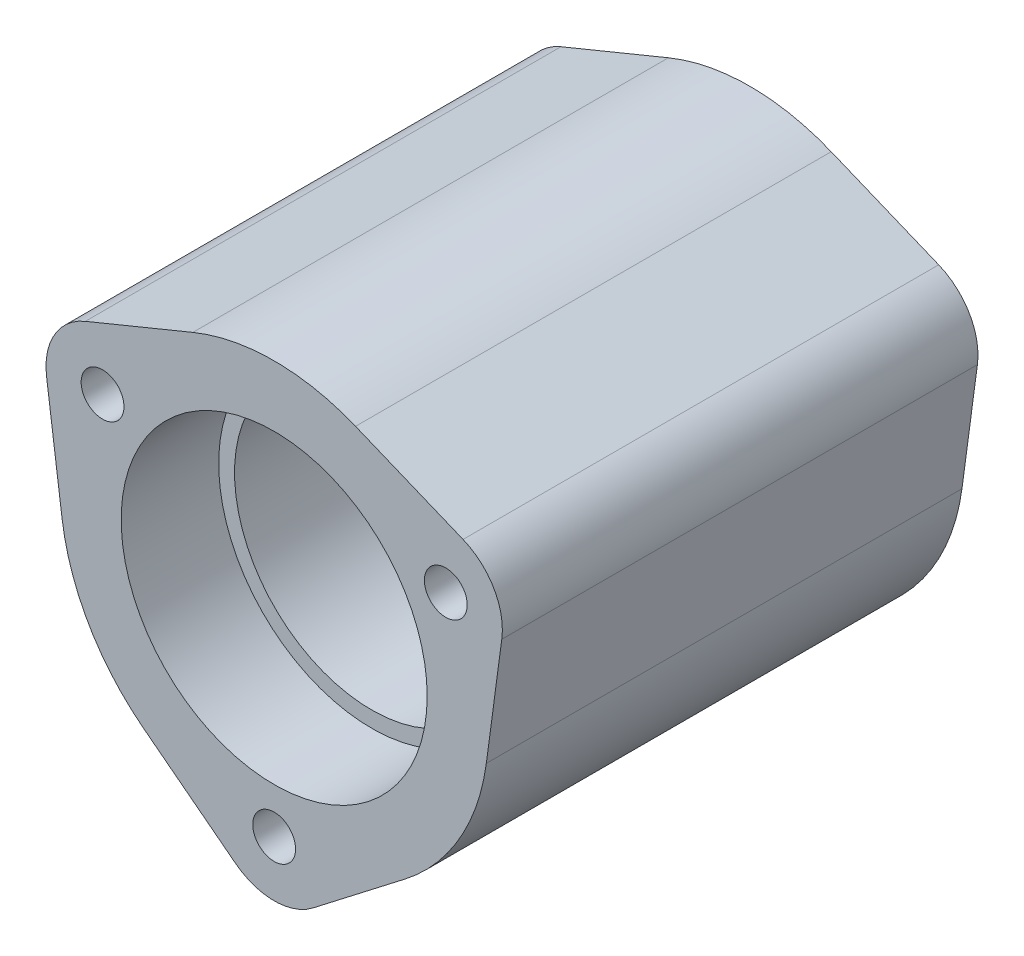
from build123d import *

# Parameters (mm, degrees)
EXTRUDE_769_DEPTH      = 15
SKETCH_2_R             = 9.65
CUT_EXTRUDE_1101_DEPTH = 6.15
SKETCH_3_R             = 8.65
CUT_EXTRUDE_1243_DEPTH = 33.124148841
SKETCH_4_R             = 1.35
CUT_EXTRUDE_1735_DEPTH = 11


with BuildPart() as part:
    # Эскиз1 → Extrude 769 (new, symmetric)
    with BuildSketch(Plane.XY):
        with BuildLine():
            Line((-11.912812099, 9.699737517), (-5.131711981, 12.486614118))
            ThreePointArc((-5.131711981, 12.486614118), (0, 13.5), (5.131711981, 12.486614118))
            Line((5.131711981, 12.486614118), (11.912812099, 9.699737517))
            ThreePointArc((11.912812099, 9.699737517), (13.856406461, 8), (14.356625149, 5.46692915))
            Line((14.356625149, 5.46692915), (13.379581024, -1.799114118))
            ThreePointArc((13.379581024, -1.799114118), (11.691342951, -6.75), (8.247869043, -10.6875))
            Line((8.247869043, -10.6875), (2.44381305, -15.166666667))
            ThreePointArc((2.44381305, -15.166666667), (0, -16), (-2.44381305, -15.166666667))
            Line((-2.44381305, -15.166666667), (-8.247869043, -10.6875))
            ThreePointArc((-8.247869043, -10.6875), (-11.691342951, -6.75), (-13.379581024, -1.799114118))
            Line((-13.379581024, -1.799114118), (-14.356625149, 5.46692915))
            ThreePointArc((-14.356625149, 5.46692915), (-13.856406461, 8), (-11.912812099, 9.699737517))
        make_face()
    extrude(amount=EXTRUDE_769_DEPTH, both=True)

    # Эскиз2 → Cut-Extrude 1101 (cut)
    with BuildSketch(Plane.XY.offset(15)):
        Circle(SKETCH_2_R)
    cut_extrude_1101 = extrude(amount=-CUT_EXTRUDE_1101_DEPTH, mode=Mode.SUBTRACT)

    # Mirror 1143: Cut-Extrude 1101 across plane
    add(cut_extrude_1101.mirror(Plane.XY), mode=Mode.SUBTRACT)

    # Эскиз3 → Cut-Extrude 1243 (cut, through all)
    with BuildSketch(Plane.XY.offset(8.85)):
        Circle(SKETCH_3_R)
    extrude(amount=-CUT_EXTRUDE_1243_DEPTH, mode=Mode.SUBTRACT)

    # Эскиз4 → Cut-Extrude 1735 (cut)
    with BuildSketch(Plane.XY.offset(15)):
        with Locations((-10.825317547, 6.25)):
            Circle(SKETCH_4_R)
        with Locations((0, -12.5)):
            Circle(SKETCH_4_R)
        with Locations((10.825317547, 6.25)):
            Circle(SKETCH_4_R)
    cut_extrude_1735 = extrude(amount=-CUT_EXTRUDE_1735_DEPTH, mode=Mode.SUBTRACT)

    # Mirror 1779: Cut-Extrude 1735 across plane
    add(cut_extrude_1735.mirror(Plane.XY), mode=Mode.SUBTRACT)


solid = part.part
